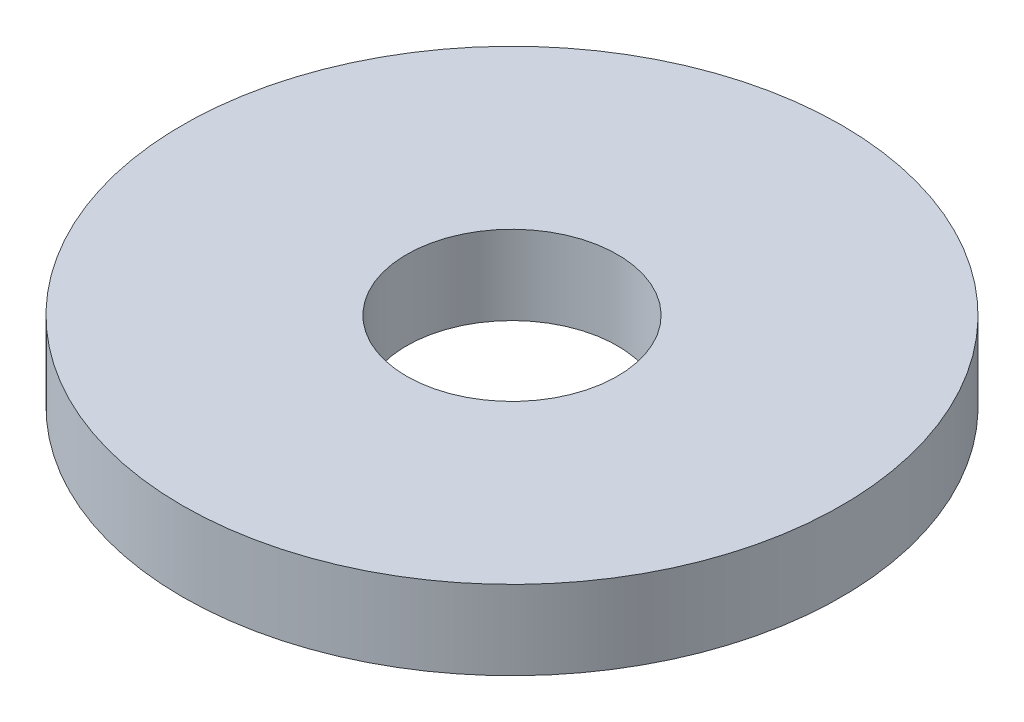
from build123d import *

# Parameters (mm, degrees)
SKETCH1_R           = 12.5
SKETCH1_R_2         = 4
BOSS_EXTRUDE1_DEPTH = 3


with BuildPart() as part:
    # Sketch1 → Boss-Extrude1 (new body)
    with BuildSketch(Plane(origin=(0, 0, 0), x_dir=(1, 0, 0), z_dir=(0, 1, 0))):
        with Locations(Location((0, 0, 0), (0, 0, 270))):
            Circle(SKETCH1_R)
        with Locations(Location((0, 0, 0), (0, 0, 270))):
            Circle(SKETCH1_R_2, mode=Mode.SUBTRACT)
    extrude(amount=BOSS_EXTRUDE1_DEPTH)


solid = part.part
